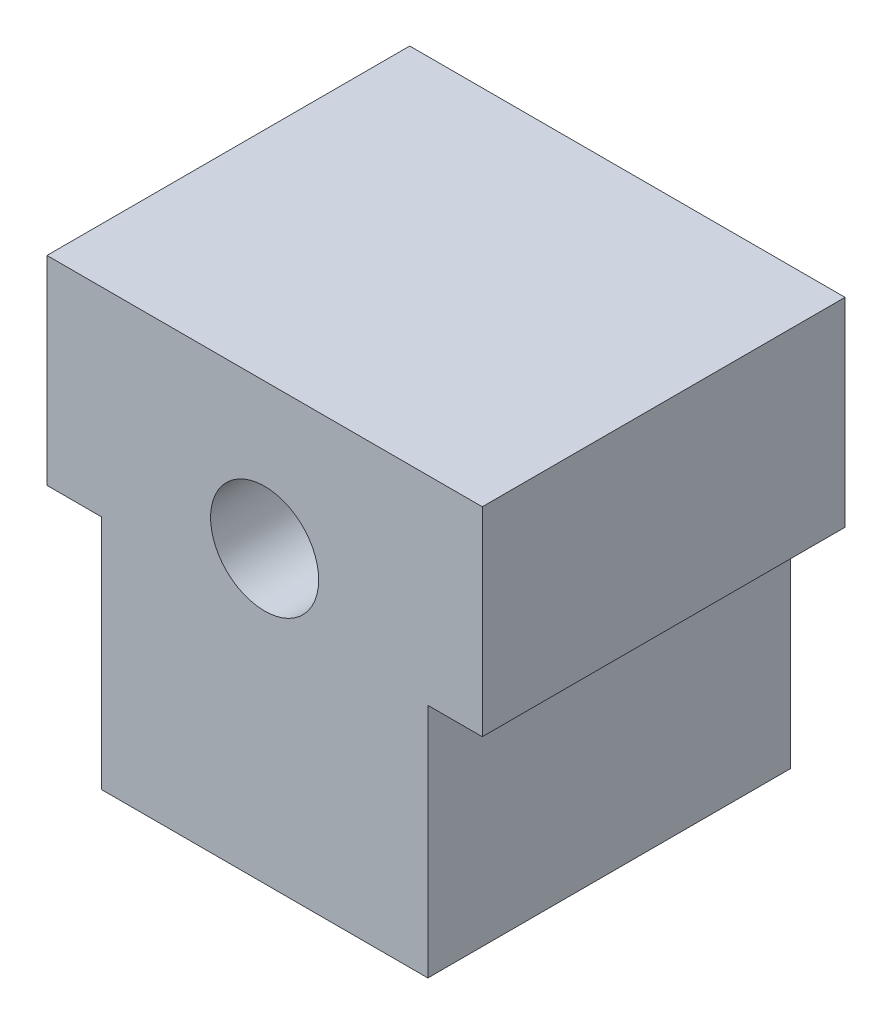
from build123d import *

# Parameters (mm, degrees)
SKETCH1_R           = 1.49
BOSS_EXTRUDE1_DEPTH = 10


with BuildPart() as part:
    # Sketch1 → Boss-Extrude1 (new body)
    with BuildSketch(Plane.XY):
        Polygon((-7.290134494, -0.663740173), (-8.790134494, -0.663740173), (-8.790134494, 4.826259827), (3.209865506, 4.826259827), (3.209865506, -0.663740173), (1.709865506, -0.663740173), (1.709865506, -7.173740173), (-7.290134494, -7.173740173), align=None)
        with Locations((-2.790134494, 0.826259827)):
            Circle(SKETCH1_R, mode=Mode.SUBTRACT)
    extrude(amount=BOSS_EXTRUDE1_DEPTH)


solid = part.part
